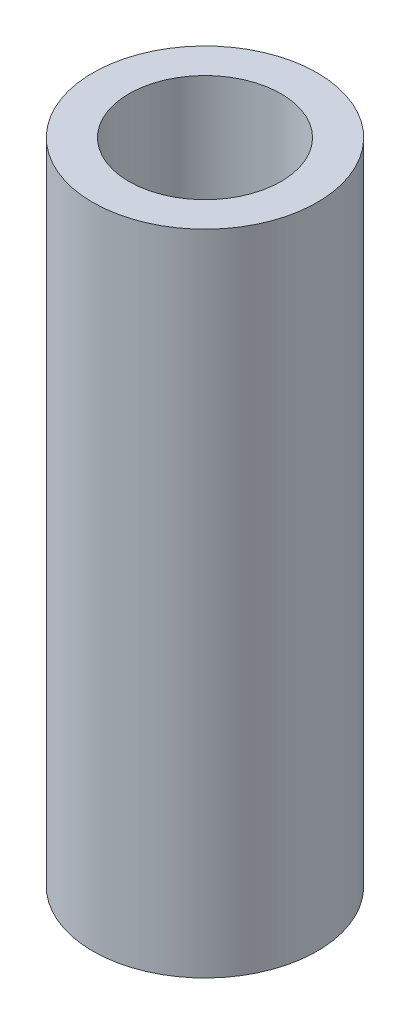
from build123d import *

# Parameters (mm, degrees)
SKETCH1_W = 1.45
SKETCH1_H = 26


with BuildPart() as part:
    # Sketch1 → Revolve1 (revolve)
    with BuildSketch(Plane.XY, mode=Mode.PRIVATE) as revolve1_sk:
        with Locations((-3.775, -17.801692553)):
            Rectangle(SKETCH1_W, SKETCH1_H)
    revolve(revolve1_sk.sketch.rotate(Axis((0, 58.538116559, 0), (0, -1, 0)), 270), axis=Axis((0, 58.538116559, 0), (0, -1, 0)))


solid = part.part
